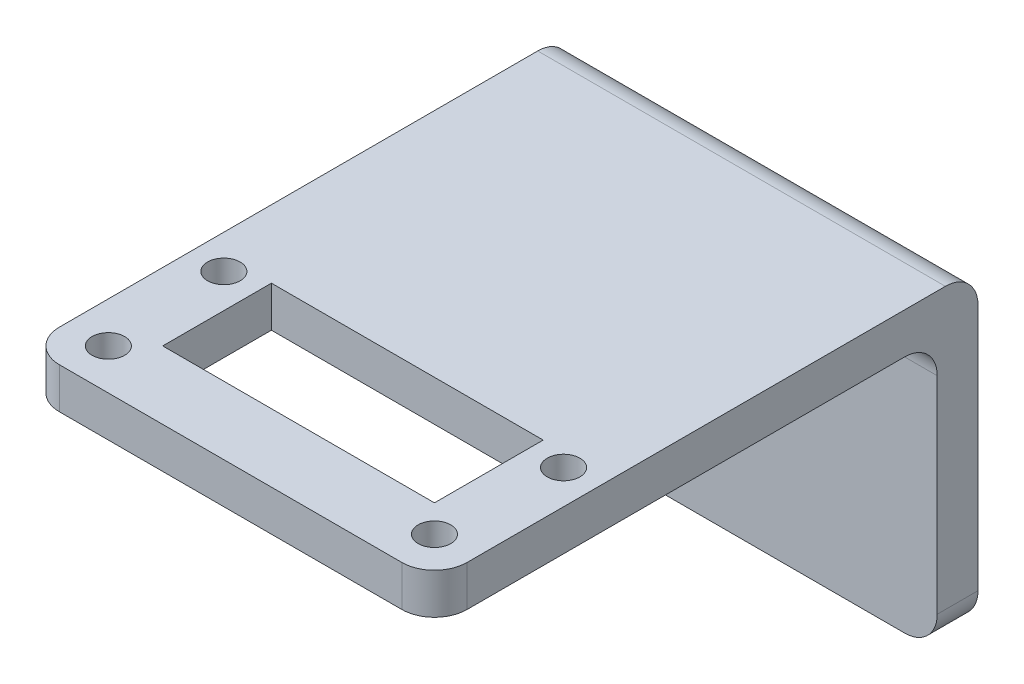
from build123d import *

# Parameters (mm, degrees)
ESBO_O1_W                = 30
ESBO_O1_H                = 40
RESSALTO_EXTRUS_O1_DEPTH = 3
ESBO_O2_W                = 20
ESBO_O2_H                = 8
CORTE_EXTRUS_O1_DEPTH    = 26.179356624
ESBO_O3_R                = 1.2
CORTE_EXTRUS_O2_DEPTH    = 26.179356624
ESBO_O4_W                = 30
ESBO_O4_H                = 3
RESSALTO_EXTRUS_O2_DEPTH = 20
FILETE5_R                = 2.4
FILETE6_R                = 2.4
FILETE7_R                = 2.4
FILETE8_R                = 2.4


with BuildPart() as part:
    # Esboço1 → Ressalto-extrusão1 (new body)
    with BuildSketch(Plane(origin=(0, 0, 0), x_dir=(1, 0, 0), z_dir=(0, 1, 0))):
        Rectangle(ESBO_O1_W, ESBO_O1_H)
    extrude(amount=RESSALTO_EXTRUS_O1_DEPTH)

    # Esboço2 → Corte-extrusão1 (cut, through all)
    with BuildSketch(Plane(origin=(0, 3, 0), x_dir=(1, 0, 0), z_dir=(0, 1, 0))):
        with Locations((0, -11)):
            Rectangle(ESBO_O2_W, ESBO_O2_H)
    extrude(amount=-CORTE_EXTRUS_O1_DEPTH, mode=Mode.SUBTRACT)

    # Esboço3 → Corte-extrusão2 (cut, through all)
    with BuildSketch(Plane.XZ):
        with Locations(Location((-12, 17, 0), (0, 0, 270))):
            Circle(ESBO_O3_R)
        with Locations(Location((12, 17, 0), (0, 0, 270))):
            Circle(ESBO_O3_R)
        with Locations(Location((-12.5, 8, 0), (0, 0, 270))):
            Circle(ESBO_O3_R)
        with Locations(Location((12.5, 8, 0), (0, 0, 270))):
            Circle(ESBO_O3_R)
    extrude(amount=-CORTE_EXTRUS_O2_DEPTH, mode=Mode.SUBTRACT)

    # Esboço4 → Ressalto-extrusão2 (add)
    with BuildSketch(Plane.XZ):
        with Locations((0, -18.5)):
            Rectangle(ESBO_O4_W, ESBO_O4_H)
    extrude(amount=RESSALTO_EXTRUS_O2_DEPTH)

    # Filete5
    filete5_edges = [part.edges().sort_by_distance(p)[0] for p in [
        (0, 0, -17),
    ]]
    fillet(filete5_edges, radius=FILETE5_R)

    # Filete6
    filete6_edges = [part.edges().sort_by_distance(p)[0] for p in [
        (0, 3, -20),
    ]]
    fillet(filete6_edges, radius=FILETE6_R)

    # Filete7
    filete7_edges = [part.edges().sort_by_distance(p)[0] for p in [
        (15, 1.5, 20),
        (-15, 1.5, 20),
    ]]
    fillet(filete7_edges, radius=FILETE7_R)

    # Filete8
    filete8_edges = [part.edges().sort_by_distance(p)[0] for p in [
        (-15, -20, -18.5),
        (15, -20, -18.5),
    ]]
    fillet(filete8_edges, radius=FILETE8_R)


solid = part.part
